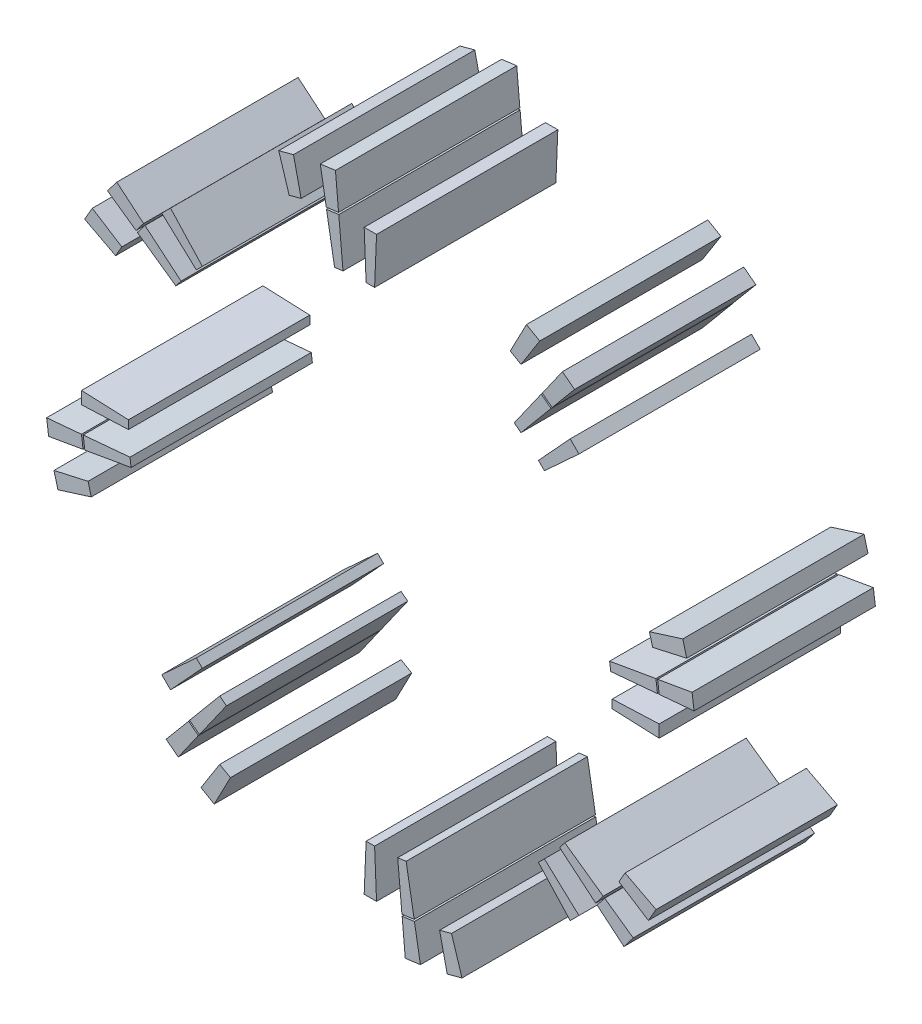
from build123d import *

# Parameters (mm, degrees)
SLOT_COPPER_ENVELOPES_START    = -20
SLOT_COPPER_ENVELOPES_DEPTH    = 40
SLOT_COPPER_ENVELOPES_2_DEPTH  = 40
SLOT_COPPER_ENVELOPES_3_DEPTH  = 40
SLOT_COPPER_ENVELOPES_4_DEPTH  = 40
SLOT_COPPER_ENVELOPES_5_DEPTH  = 40
SLOT_COPPER_ENVELOPES_6_DEPTH  = 40
SLOT_COPPER_ENVELOPES_7_DEPTH  = 40
SLOT_COPPER_ENVELOPES_8_DEPTH  = 40
SLOT_COPPER_ENVELOPES_9_DEPTH  = 40
SLOT_COPPER_ENVELOPES_10_DEPTH = 40
SLOT_COPPER_ENVELOPES_11_DEPTH = 40
SLOT_COPPER_ENVELOPES_12_DEPTH = 40
SLOT_COPPER_ENVELOPES_13_DEPTH = 40
SLOT_COPPER_ENVELOPES_14_DEPTH = 40
SLOT_COPPER_ENVELOPES_15_DEPTH = 40
SLOT_COPPER_ENVELOPES_16_DEPTH = 40
SLOT_COPPER_ENVELOPES_17_DEPTH = 40
SLOT_COPPER_ENVELOPES_18_DEPTH = 40
SLOT_COPPER_ENVELOPES_19_DEPTH = 40
SLOT_COPPER_ENVELOPES_20_DEPTH = 40
SLOT_COPPER_ENVELOPES_21_DEPTH = 40
SLOT_COPPER_ENVELOPES_22_DEPTH = 40
SLOT_COPPER_ENVELOPES_23_DEPTH = 40
SLOT_COPPER_ENVELOPES_24_DEPTH = 40
SLOT_COPPER_ENVELOPES_25_DEPTH = 40
SLOT_COPPER_ENVELOPES_26_DEPTH = 40
SLOT_COPPER_ENVELOPES_27_DEPTH = 40
SLOT_COPPER_ENVELOPES_28_DEPTH = 40
SLOT_COPPER_ENVELOPES_29_DEPTH = 40
SLOT_COPPER_ENVELOPES_30_DEPTH = 40
SLOT_COPPER_ENVELOPES_31_DEPTH = 40
SLOT_COPPER_ENVELOPES_32_DEPTH = 40


with BuildPart() as part:
    # Эскиз1 → Slot_copper_envelopes (new body)
    with BuildSketch(Plane.XY.offset(SLOT_COPPER_ENVELOPES_START)):
        Polygon((53.368689425, -0.9375), (63.723076923, -1.364772727), (63.723076923, 1.364772727), (53.368689425, 0.9375), align=None)
    extrude(amount=SLOT_COPPER_ENVELOPES_DEPTH)


with BuildPart() as body_2:
    # Эскиз1 → Slot_copper_envelopes 2 (new body)
    with BuildSketch(Plane.XY.offset(SLOT_COPPER_ENVELOPES_START)):
        Polygon((63.738232651, 7.014748223), (71.421256994, 7.700725493), (70.980731095, 11.0468519), (63.381955476, 9.720942038), align=None)
    extrude(amount=SLOT_COPPER_ENVELOPES_2_DEPTH)


with BuildPart() as body_3:
    # Эскиз1 → Slot_copper_envelopes 3 (new body)
    with BuildSketch(Plane.XY.offset(SLOT_COPPER_ENVELOPES_START)):
        Polygon((53.034481194, 6.036532257), (63.356055754, 6.96443368), (62.999778579, 9.670627495), (52.789744583, 7.895491372), align=None)
    extrude(amount=SLOT_COPPER_ENVELOPES_3_DEPTH)


with BuildPart() as body_4:
    # Эскиз1 → Slot_copper_envelopes 4 (new body)
    with BuildSketch(Plane.XY.offset(SLOT_COPPER_ENVELOPES_START)):
        Polygon((62.27733486, 15.274244886), (69.805091863, 16.957189438), (68.931577586, 20.217189102), (61.570876512, 17.910783335), align=None)
    extrude(amount=SLOT_COPPER_ENVELOPES_4_DEPTH)


with BuildPart() as body_5:
    # Эскиз1 → Slot_copper_envelopes 5 (new body)
    with BuildSketch(Plane.XY.offset(SLOT_COPPER_ENVELOPES_START)):
        Polygon((38.400274803, 37.074449588), (46.024059861, 44.09397976), (44.09397976, 46.024059861), (37.074449588, 38.400274803), align=None)
    extrude(amount=SLOT_COPPER_ENVELOPES_5_DEPTH)


with BuildPart() as body_6:
    # Эскиз1 → Slot_copper_envelopes 6 (new body)
    with BuildSketch(Plane.XY.offset(SLOT_COPPER_ENVELOPES_START)):
        Polygon((40.109560491, 50.029912565), (45.057219925, 55.947690357), (42.379652402, 58.00226018), (37.944066488, 51.691554556), align=None)
    extrude(amount=SLOT_COPPER_ENVELOPES_6_DEPTH)


with BuildPart() as body_7:
    # Эскиз1 → Slot_copper_envelopes 7 (new body)
    with BuildSketch(Plane.XY.offset(SLOT_COPPER_ENVELOPES_START)):
        Polygon((33.232568395, 41.769514182), (39.87489837, 49.724094935), (37.709404367, 51.385736926), (31.745030882, 42.910941862), align=None)
    extrude(amount=SLOT_COPPER_ENVELOPES_7_DEPTH)


with BuildPart() as body_8:
    # Эскиз1 → Slot_copper_envelopes 8 (new body)
    with BuildSketch(Plane.XY.offset(SLOT_COPPER_ENVELOPES_START)):
        Polygon((33.236203657, 54.83724793), (37.369110177, 61.350197459), (34.446274439, 63.037697459), (30.872347953, 56.202020657), align=None)
    extrude(amount=SLOT_COPPER_ENVELOPES_8_DEPTH)


with BuildPart() as body_9:
    # Эскиз1 → Slot_copper_envelopes 9 (new body)
    with BuildSketch(Plane.XY.offset(SLOT_COPPER_ENVELOPES_START)):
        Polygon((0.9375, 53.368689425), (1.364772727, 63.723076923), (-1.364772727, 63.723076923), (-0.9375, 53.368689425), align=None)
    extrude(amount=SLOT_COPPER_ENVELOPES_9_DEPTH)


with BuildPart() as body_10:
    # Эскиз1 → Slot_copper_envelopes 10 (new body)
    with BuildSketch(Plane.XY.offset(SLOT_COPPER_ENVELOPES_START)):
        Polygon((-7.014748223, 63.738232651), (-7.700725493, 71.421256994), (-11.0468519, 70.980731095), (-9.720942038, 63.381955476), align=None)
    extrude(amount=SLOT_COPPER_ENVELOPES_10_DEPTH)


with BuildPart() as body_11:
    # Эскиз1 → Slot_copper_envelopes 11 (new body)
    with BuildSketch(Plane.XY.offset(SLOT_COPPER_ENVELOPES_START)):
        Polygon((-6.036532257, 53.034481194), (-6.96443368, 63.356055754), (-9.670627495, 62.999778579), (-7.895491372, 52.789744583), align=None)
    extrude(amount=SLOT_COPPER_ENVELOPES_11_DEPTH)


with BuildPart() as body_12:
    # Эскиз1 → Slot_copper_envelopes 12 (new body)
    with BuildSketch(Plane.XY.offset(SLOT_COPPER_ENVELOPES_START)):
        Polygon((-15.274244886, 62.27733486), (-16.957189438, 69.805091863), (-20.217189102, 68.931577586), (-17.910783335, 61.570876512), align=None)
    extrude(amount=SLOT_COPPER_ENVELOPES_12_DEPTH)


with BuildPart() as body_13:
    # Эскиз1 → Slot_copper_envelopes 13 (new body)
    with BuildSketch(Plane.XY.offset(SLOT_COPPER_ENVELOPES_START)):
        Polygon((-37.074449588, 38.400274803), (-44.09397976, 46.024059861), (-46.024059861, 44.09397976), (-38.400274803, 37.074449588), align=None)
    extrude(amount=SLOT_COPPER_ENVELOPES_13_DEPTH)


with BuildPart() as body_14:
    # Эскиз1 → Slot_copper_envelopes 14 (new body)
    with BuildSketch(Plane.XY.offset(SLOT_COPPER_ENVELOPES_START)):
        Polygon((-50.029912565, 40.109560491), (-55.947690357, 45.057219925), (-58.00226018, 42.379652402), (-51.691554556, 37.944066488), align=None)
    extrude(amount=SLOT_COPPER_ENVELOPES_14_DEPTH)


with BuildPart() as body_15:
    # Эскиз1 → Slot_copper_envelopes 15 (new body)
    with BuildSketch(Plane.XY.offset(SLOT_COPPER_ENVELOPES_START)):
        Polygon((-41.769514182, 33.232568395), (-49.724094935, 39.87489837), (-51.385736926, 37.709404367), (-42.910941862, 31.745030882), align=None)
    extrude(amount=SLOT_COPPER_ENVELOPES_15_DEPTH)


with BuildPart() as body_16:
    # Эскиз1 → Slot_copper_envelopes 16 (new body)
    with BuildSketch(Plane.XY.offset(SLOT_COPPER_ENVELOPES_START)):
        Polygon((-54.83724793, 33.236203657), (-61.350197459, 37.369110177), (-63.037697459, 34.446274439), (-56.202020657, 30.872347953), align=None)
    extrude(amount=SLOT_COPPER_ENVELOPES_16_DEPTH)


with BuildPart() as body_17:
    # Эскиз1 → Slot_copper_envelopes 17 (new body)
    with BuildSketch(Plane.XY.offset(SLOT_COPPER_ENVELOPES_START)):
        Polygon((-53.368689425, 0.9375), (-63.723076923, 1.364772727), (-63.723076923, -1.364772727), (-53.368689425, -0.9375), align=None)
    extrude(amount=SLOT_COPPER_ENVELOPES_17_DEPTH)


with BuildPart() as body_18:
    # Эскиз1 → Slot_copper_envelopes 18 (new body)
    with BuildSketch(Plane.XY.offset(SLOT_COPPER_ENVELOPES_START)):
        Polygon((-63.738232651, -7.014748223), (-71.421256994, -7.700725493), (-70.980731095, -11.0468519), (-63.381955476, -9.720942038), align=None)
    extrude(amount=SLOT_COPPER_ENVELOPES_18_DEPTH)


with BuildPart() as body_19:
    # Эскиз1 → Slot_copper_envelopes 19 (new body)
    with BuildSketch(Plane.XY.offset(SLOT_COPPER_ENVELOPES_START)):
        Polygon((-53.034481194, -6.036532257), (-63.356055754, -6.96443368), (-62.999778579, -9.670627495), (-52.789744583, -7.895491372), align=None)
    extrude(amount=SLOT_COPPER_ENVELOPES_19_DEPTH)


with BuildPart() as body_20:
    # Эскиз1 → Slot_copper_envelopes 20 (new body)
    with BuildSketch(Plane.XY.offset(SLOT_COPPER_ENVELOPES_START)):
        Polygon((-62.27733486, -15.274244886), (-69.805091863, -16.957189438), (-68.931577586, -20.217189102), (-61.570876512, -17.910783335), align=None)
    extrude(amount=SLOT_COPPER_ENVELOPES_20_DEPTH)


with BuildPart() as body_21:
    # Эскиз1 → Slot_copper_envelopes 21 (new body)
    with BuildSketch(Plane.XY.offset(SLOT_COPPER_ENVELOPES_START)):
        Polygon((-38.400274803, -37.074449588), (-46.024059861, -44.09397976), (-44.09397976, -46.024059861), (-37.074449588, -38.400274803), align=None)
    extrude(amount=SLOT_COPPER_ENVELOPES_21_DEPTH)


with BuildPart() as body_22:
    # Эскиз1 → Slot_copper_envelopes 22 (new body)
    with BuildSketch(Plane.XY.offset(SLOT_COPPER_ENVELOPES_START)):
        Polygon((-40.109560491, -50.029912565), (-45.057219925, -55.947690357), (-42.379652402, -58.00226018), (-37.944066488, -51.691554556), align=None)
    extrude(amount=SLOT_COPPER_ENVELOPES_22_DEPTH)


with BuildPart() as body_23:
    # Эскиз1 → Slot_copper_envelopes 23 (new body)
    with BuildSketch(Plane.XY.offset(SLOT_COPPER_ENVELOPES_START)):
        Polygon((-33.232568395, -41.769514182), (-39.87489837, -49.724094935), (-37.709404367, -51.385736926), (-31.745030882, -42.910941862), align=None)
    extrude(amount=SLOT_COPPER_ENVELOPES_23_DEPTH)


with BuildPart() as body_24:
    # Эскиз1 → Slot_copper_envelopes 24 (new body)
    with BuildSketch(Plane.XY.offset(SLOT_COPPER_ENVELOPES_START)):
        Polygon((-33.236203657, -54.83724793), (-37.369110177, -61.350197459), (-34.446274439, -63.037697459), (-30.872347953, -56.202020657), align=None)
    extrude(amount=SLOT_COPPER_ENVELOPES_24_DEPTH)


with BuildPart() as body_25:
    # Эскиз1 → Slot_copper_envelopes 25 (new body)
    with BuildSketch(Plane.XY.offset(SLOT_COPPER_ENVELOPES_START)):
        Polygon((-0.9375, -53.368689425), (-1.364772727, -63.723076923), (1.364772727, -63.723076923), (0.9375, -53.368689425), align=None)
    extrude(amount=SLOT_COPPER_ENVELOPES_25_DEPTH)


with BuildPart() as body_26:
    # Эскиз1 → Slot_copper_envelopes 26 (new body)
    with BuildSketch(Plane.XY.offset(SLOT_COPPER_ENVELOPES_START)):
        Polygon((7.014748223, -63.738232651), (7.700725493, -71.421256994), (11.0468519, -70.980731095), (9.720942038, -63.381955476), align=None)
    extrude(amount=SLOT_COPPER_ENVELOPES_26_DEPTH)


with BuildPart() as body_27:
    # Эскиз1 → Slot_copper_envelopes 27 (new body)
    with BuildSketch(Plane.XY.offset(SLOT_COPPER_ENVELOPES_START)):
        Polygon((6.036532257, -53.034481194), (6.96443368, -63.356055754), (9.670627495, -62.999778579), (7.895491372, -52.789744583), align=None)
    extrude(amount=SLOT_COPPER_ENVELOPES_27_DEPTH)


with BuildPart() as body_28:
    # Эскиз1 → Slot_copper_envelopes 28 (new body)
    with BuildSketch(Plane.XY.offset(SLOT_COPPER_ENVELOPES_START)):
        Polygon((15.274244886, -62.27733486), (16.957189438, -69.805091863), (20.217189102, -68.931577586), (17.910783335, -61.570876512), align=None)
    extrude(amount=SLOT_COPPER_ENVELOPES_28_DEPTH)


with BuildPart() as body_29:
    # Эскиз1 → Slot_copper_envelopes 29 (new body)
    with BuildSketch(Plane.XY.offset(SLOT_COPPER_ENVELOPES_START)):
        Polygon((37.074449588, -38.400274803), (44.09397976, -46.024059861), (46.024059861, -44.09397976), (38.400274803, -37.074449588), align=None)
    extrude(amount=SLOT_COPPER_ENVELOPES_29_DEPTH)


with BuildPart() as body_30:
    # Эскиз1 → Slot_copper_envelopes 30 (new body)
    with BuildSketch(Plane.XY.offset(SLOT_COPPER_ENVELOPES_START)):
        Polygon((50.029912565, -40.109560491), (55.947690357, -45.057219925), (58.00226018, -42.379652402), (51.691554556, -37.944066488), align=None)
    extrude(amount=SLOT_COPPER_ENVELOPES_30_DEPTH)


with BuildPart() as body_31:
    # Эскиз1 → Slot_copper_envelopes 31 (new body)
    with BuildSketch(Plane.XY.offset(SLOT_COPPER_ENVELOPES_START)):
        Polygon((41.769514182, -33.232568395), (49.724094935, -39.87489837), (51.385736926, -37.709404367), (42.910941862, -31.745030882), align=None)
    extrude(amount=SLOT_COPPER_ENVELOPES_31_DEPTH)


with BuildPart() as body_32:
    # Эскиз1 → Slot_copper_envelopes 32 (new body)
    with BuildSketch(Plane.XY.offset(SLOT_COPPER_ENVELOPES_START)):
        Polygon((54.83724793, -33.236203657), (61.350197459, -37.369110177), (63.037697459, -34.446274439), (56.202020657, -30.872347953), align=None)
    extrude(amount=SLOT_COPPER_ENVELOPES_32_DEPTH)


solid = Compound([part.part, body_2.part, body_3.part, body_4.part, body_5.part, body_6.part, body_7.part, body_8.part, body_9.part, body_10.part, body_11.part, body_12.part, body_13.part, body_14.part, body_15.part, body_16.part, body_17.part, body_18.part, body_19.part, body_20.part, body_21.part, body_22.part, body_23.part, body_24.part, body_25.part, body_26.part, body_27.part, body_28.part, body_29.part, body_30.part, body_31.part, body_32.part])
